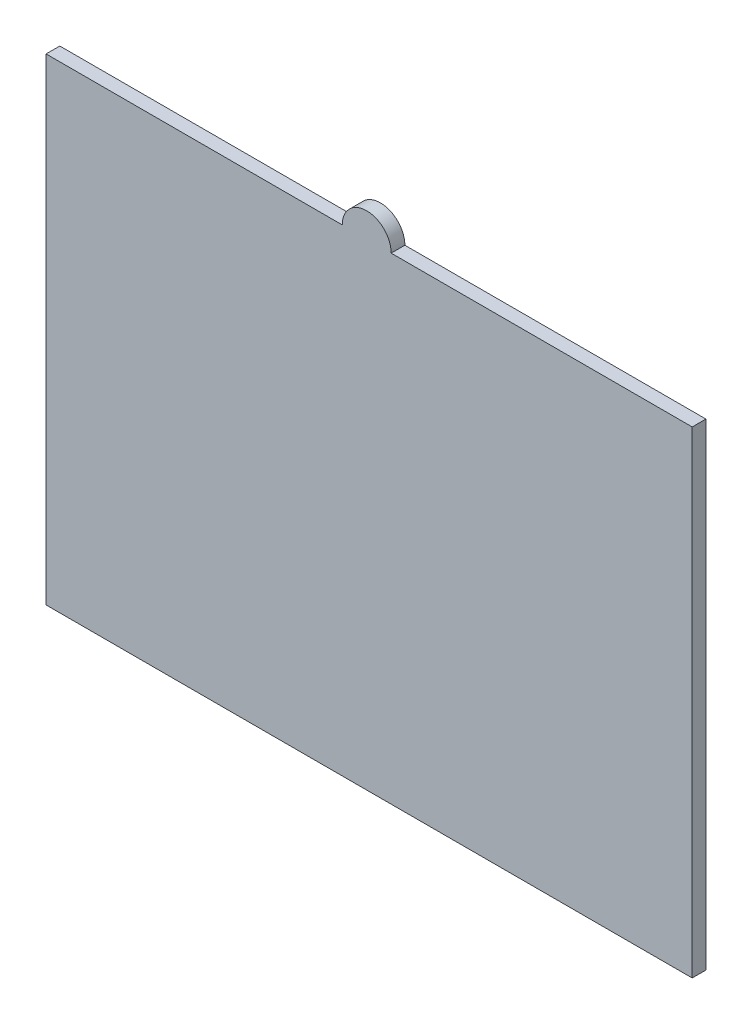
from build123d import *

# Parameters (mm, degrees)
BOSS_EXTRUDE1_DEPTH = 2.8


with BuildPart() as part:
    # Sketch1 → Boss-Extrude1 (new body)
    with BuildSketch(Plane.XY):
        with BuildLine():
            Line((5, 48.5), (66.5, 48.5))
            Line((66.5, 48.5), (66.5, -49))
            Line((66.5, -49), (-65.5, -49))
            Line((-65.5, -49), (-65.5, 48.5))
            Line((-65.5, 48.5), (-5, 48.5))
            ThreePointArc((-5, 48.5), (0, 53.5), (5, 48.5))
        make_face()
    extrude(amount=BOSS_EXTRUDE1_DEPTH)


solid = part.part
